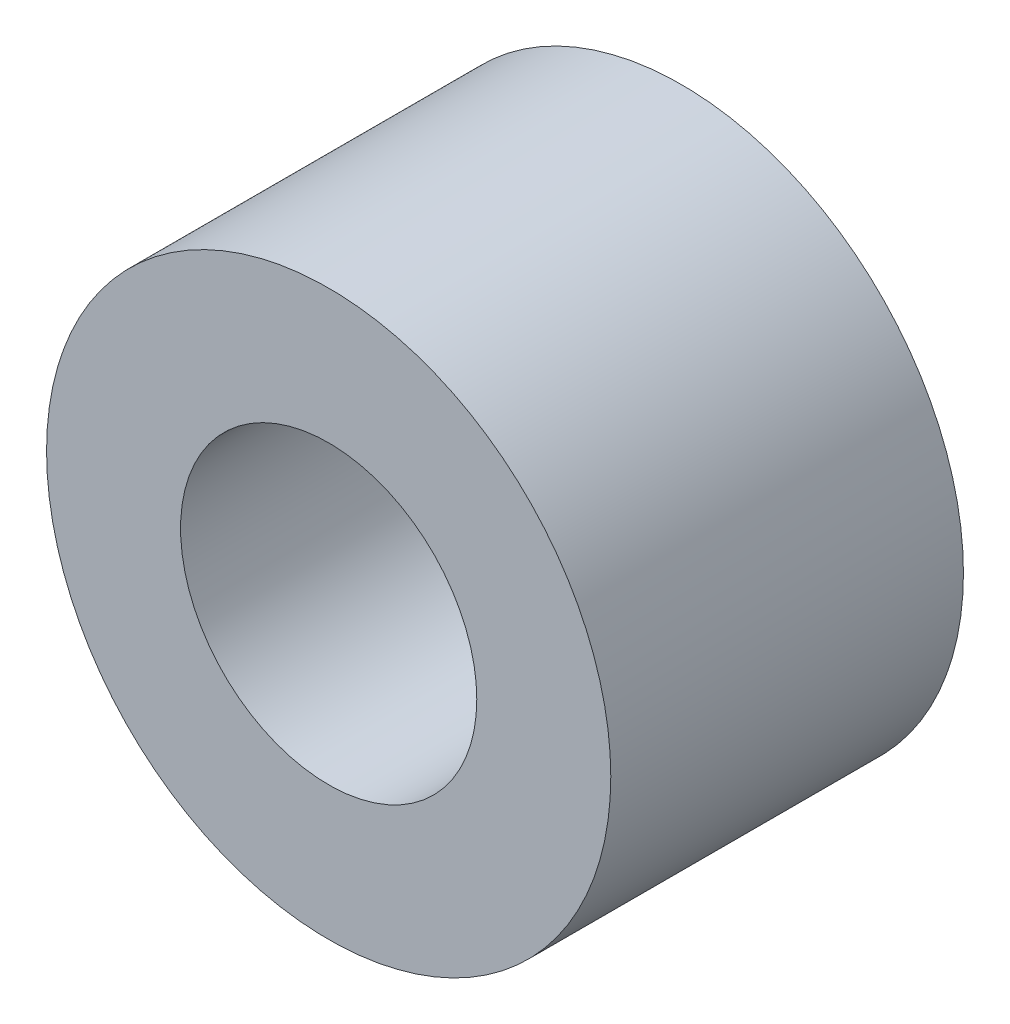
from build123d import *

# Parameters (mm, degrees)
SKETCH1_R           = 4
SKETCH1_R_2         = 2.1
BOSS_EXTRUDE1_DEPTH = 5


with BuildPart() as part:
    # Sketch1 → Boss-Extrude1 (new body)
    with BuildSketch(Plane.XY):
        Circle(SKETCH1_R)
        Circle(SKETCH1_R_2, mode=Mode.SUBTRACT)
    extrude(amount=BOSS_EXTRUDE1_DEPTH)


solid = part.part
